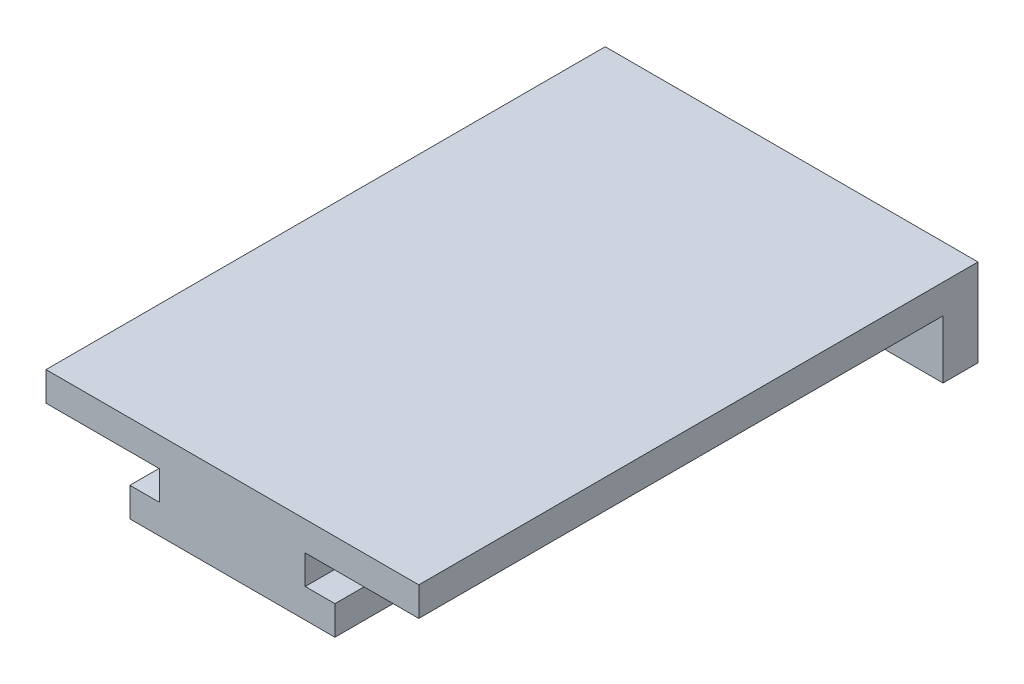
from build123d import *

# Parameters (mm, degrees)
SKETCH1_W           = 6.25
SKETCH1_H           = 2.5
SKETCH1_W_2         = 8.8
BOSS_EXTRUDE1_DEPTH = 45
SKETCH9_W           = 32
SKETCH9_H           = 7.5
BOSS_EXTRUDE3_DEPTH = 3


with BuildPart() as part:
    # Sketch1 → Boss-Extrude1 (new body)
    with BuildSketch(Plane.XY):
        Polygon((-3.202898551, 2.789855072), (-3.202898551, 0.289855072), (3.047101449, 0.289855072), (12.797101449, 0.289855072), (12.797101449, 2.789855072), align=None)
        with Locations((-0.077898551, -0.960144928)):
            Rectangle(SKETCH1_W, SKETCH1_H)
        with Locations((1.197101449, -3.460144928)):
            Rectangle(SKETCH1_W_2, SKETCH1_H)
    boss_extrude1 = extrude(amount=BOSS_EXTRUDE1_DEPTH)

    # Mirror1: Boss-Extrude1 across plane
    add(boss_extrude1.mirror(Plane(origin=(-3.202898551, 0, 45), x_dir=(0, 0, 1), z_dir=(-1, 0, 0))))

    # Cut-Extrude2 cone 1 section (through the dimple's axis) → Cut-Extrude2 (revolve, cut)
    with BuildSketch(Plane(origin=(-3.202898551, -4.710144928, 32.5), x_dir=(0, 0, -1), z_dir=(1, 0, 0))):
        Polygon((0, 0), (1.5, 0), (0, 1.5), align=None)
    revolve(axis=Axis((-3.202898551, -4.710144928, 32.5), (0, 1, 0)), mode=Mode.SUBTRACT)

    # Cut-Extrude2 cone 2 section (through the dimple's axis) → Cut-Extrude2 cone 2 (revolve, cut)
    with BuildSketch(Plane(origin=(-3.202898551, -4.710144928, 12.5), x_dir=(0, 0, -1), z_dir=(1, 0, 0))):
        Polygon((0, 0), (1.5, 0), (0, 1.5), align=None)
    revolve(axis=Axis((-3.202898551, -4.710144928, 12.5), (0, 1, 0)), mode=Mode.SUBTRACT)

    # Sketch9 → Boss-Extrude3 (add)
    with BuildSketch(Plane(origin=(0, 0, 0), x_dir=(-1, 0, 0), z_dir=(0, 0, -1))):
        with Locations((3.202898551, -0.960144928)):
            Rectangle(SKETCH9_W, SKETCH9_H)
    extrude(amount=BOSS_EXTRUDE3_DEPTH)


solid = part.part
